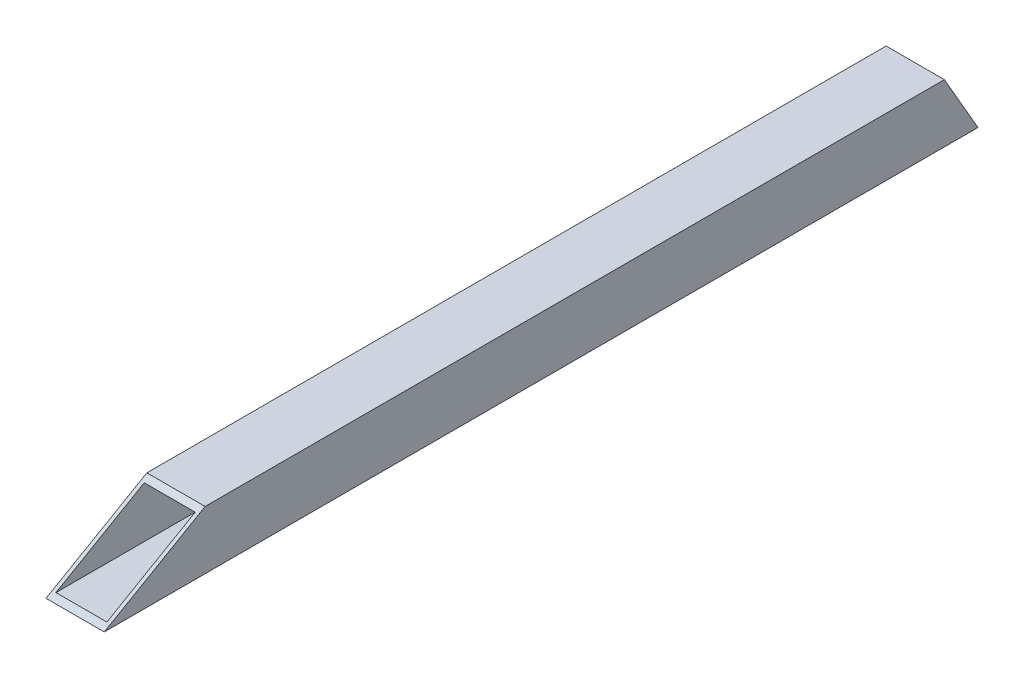
from build123d import *

# Parameters (mm, degrees)
SKETCH1_W           = 50.8
SKETCH1_H           = 50.8
SKETCH1_W_2         = 44.45
SKETCH1_H_2         = 44.45
BOSS_EXTRUDE1_DEPTH = 762
CUT_EXTRUDE1_DEPTH  = 765.11373499


with BuildPart() as part:
    # Sketch1 → Boss-Extrude1 (new body)
    with BuildSketch(Plane.XY):
        Rectangle(SKETCH1_W, SKETCH1_H)
        Rectangle(SKETCH1_W_2, SKETCH1_H_2, mode=Mode.SUBTRACT)
    extrude(amount=BOSS_EXTRUDE1_DEPTH)

    # Sketch2 → Cut-Extrude1 (cut, through all)
    with BuildSketch(Plane.ZY.offset(25.4)):
        Polygon((0, -25.4), (29.329393675, 25.4), (0, 25.4), align=None)
        Polygon((762, -25.4), (674.011818975, 25.4), (762, 25.4), align=None)
    extrude(amount=-CUT_EXTRUDE1_DEPTH, mode=Mode.SUBTRACT)


solid = part.part
